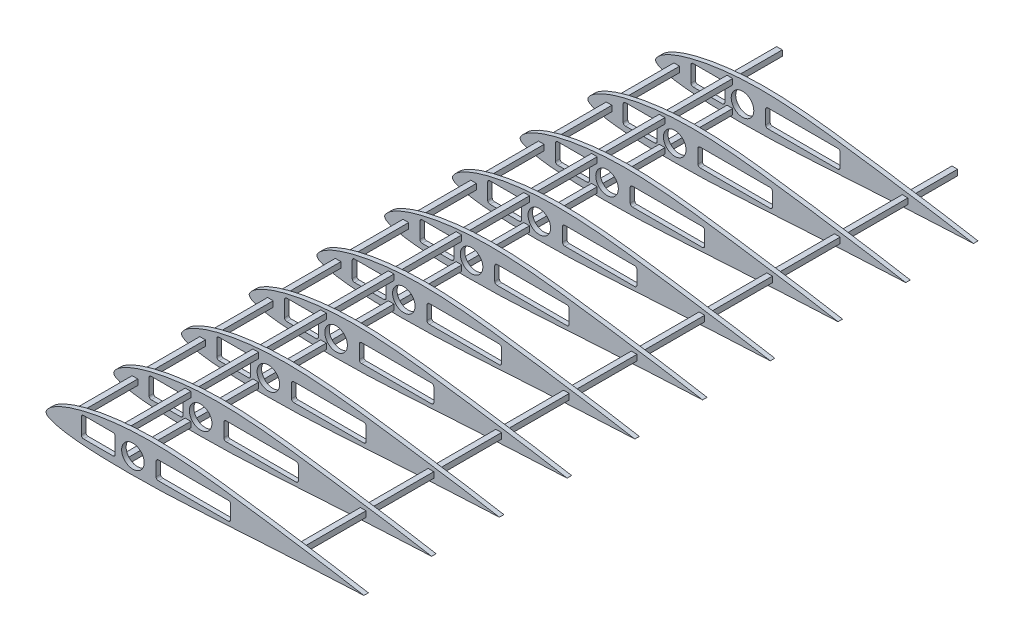
from build123d import *

# Parameters (mm, degrees)
BOSS_EXTRUDE2_DEPTH       = 5.08
BOSS_EXTRUDE3_DEPTH       = 5.08
BOSS_EXTRUDE4_DEPTH       = 5.08
BOSS_EXTRUDE5_DEPTH       = 5.08
BOSS_EXTRUDE6_DEPTH       = 5.08
BOSS_EXTRUDE7_DEPTH       = 5.08
BOSS_EXTRUDE8_DEPTH       = 5.08
BOSS_EXTRUDE9_DEPTH       = 5.08
BOSS_EXTRUDE10_DEPTH      = 5.08
BOSS_EXTRUDE11_DEPTH      = 5.08
SKETCH14_R                = 12.7
CUT_EXTRUDE2_DEPTH        = 690.88
SKETCH15_W                = 6.35
SKETCH15_H                = 6.46854383
SKETCH15_H_2              = 6.35
CUT_EXTRUDE3_DEPTH        = 779.554157664
SKETCH16_W                = 6.35
SKETCH16_H                = 6.35
BOSS_EXTRUDE12_DEPTH      = 690.88
BOSS_EXTRUDE13_DEPTH      = 50.8
BOSS_EXTRUDE13_DEPTH_BACK = 690.88
SKETCH17_W                = 6.35
SKETCH17_H                = 6.46854383
SKETCH17_H_2              = 6.35


with BuildPart() as part:
    # Sketch1 → Boss-Extrude2 (new body)
    with BuildSketch(Plane.XY):
        with BuildLine():
            add(Edge.make_bspline(
                [(357.6495768, 0), (357.650424017, 0.025663108), (354.99806757, 0.293773121), (352.370656863, 0.802364027), (346.176304678, 1.867599503), (338.781253095, 3.265504934), (329.308114231, 4.891932615), (318.248236887, 6.664827953), (305.595219858, 8.650694841), (291.563961855, 10.819266045), (276.339957136, 13.150538074), (260.139222488, 15.590297603), (243.181526396, 18.09125812), (225.69898419, 20.602703774), (207.92085948, 23.031812803), (190.087035591, 25.315205259), (172.408579332, 27.332807649), (155.046694559, 28.909580237), (138.125753593, 29.947037456), (121.743656538, 30.392160951), (105.989881508, 30.210794754), (90.943349528, 29.415500622), (76.690303822, 28.03078985), (63.327174798, 26.18677189), (50.972808774, 23.948534269), (39.752270993, 21.37905616), (29.77139745, 18.544982508), (21.131812622, 15.501783957), (13.891437198, 12.323716442), (8.139051951, 9.107469323), (3.815839027, 5.903106048), (1.180205396, 2.969325806), (-0.487670047, -0.018031277), (1.257237687, -2.928520945), (4.804987248, -4.652779402), (9.875429174, -6.636452021), (16.779998315, -8.251110396), (25.353452813, -9.701737391), (35.582842736, -10.881324092), (47.362154325, -11.802673847), (60.584190143, -12.462405601), (75.111735115, -12.860660167), (90.789721738, -13.013201083), (107.443529757, -12.913655472), (124.905168707, -12.56510888), (143.025643592, -11.886846395), (161.661678952, -10.940531092), (180.642422071, -9.857230063), (199.744199132, -8.711857459), (218.720973618, -7.552500346), (237.326277665, -6.425266584), (255.32010409, -5.353644632), (272.465183364, -4.367012218), (288.537244693, -3.475326191), (303.314765849, -2.692174609), (316.612136087, -2.020695803), (328.210351967, -1.438525319), (338.124563038, -0.910151365), (345.839521918, -0.406133073), (352.25250936, -0.129032965), (354.957272096, 0.043054655), (357.648726861, -0.025745557), (357.6495768, 0)],
                knots=[0, 0, 0, 0, 0.001748082, 0.006827365, 0.014880219, 0.025572325, 0.038694157, 0.05417078, 0.071834092, 0.091434533, 0.112684614, 0.135293129, 0.158943981, 0.183314993, 0.208069947, 0.232879416, 0.257398767, 0.281383633, 0.304705763, 0.327241497, 0.348896563, 0.36960694, 0.389308376, 0.407885696, 0.425177149, 0.44102679, 0.455299972, 0.467903885, 0.478751648, 0.487814349, 0.495090031, 0.500616983, 0.504451368, 0.507803776, 0.513091193, 0.520546229, 0.530249123, 0.542213645, 0.556382479, 0.572655502, 0.590894529, 0.610925387, 0.632535859, 0.655496365, 0.679547083, 0.704498569, 0.730211425, 0.756435525, 0.782836661, 0.80906245, 0.834775916, 0.859641281, 0.883337827, 0.905540839, 0.925965139, 0.944326313, 0.960365877, 0.973929438, 0.984907697, 0.99311134, 0.998246302, 1, 1, 1, 1], degree=3))
        make_face()
    extrude(amount=BOSS_EXTRUDE2_DEPTH)


with BuildPart() as body_2:
    # Sketch5 → Boss-Extrude3 (new body)
    with BuildSketch(Plane.XY.offset(76.2)):
        with BuildLine():
            add(Edge.make_bspline(
                [(357.6495768, 0), (357.650424017, 0.025663108), (354.99806757, 0.293773121), (352.370656863, 0.802364027), (346.176304678, 1.867599503), (338.781253095, 3.265504934), (329.308114231, 4.891932615), (318.248236887, 6.664827953), (305.595219858, 8.650694841), (291.563961855, 10.819266045), (276.339957136, 13.150538074), (260.139222488, 15.590297603), (243.181526396, 18.09125812), (225.69898419, 20.602703774), (207.92085948, 23.031812803), (190.087035591, 25.315205259), (172.408579332, 27.332807649), (155.046694559, 28.909580237), (138.125753593, 29.947037456), (121.743656538, 30.392160951), (105.989881508, 30.210794754), (90.943349528, 29.415500622), (76.690303822, 28.03078985), (63.327174798, 26.18677189), (50.972808774, 23.948534269), (39.752270993, 21.37905616), (29.77139745, 18.544982508), (21.131812622, 15.501783957), (13.891437198, 12.323716442), (8.139051951, 9.107469323), (3.815839027, 5.903106048), (1.180205396, 2.969325806), (-0.487670047, -0.018031277), (1.257237687, -2.928520945), (4.804987248, -4.652779402), (9.875429174, -6.636452021), (16.779998315, -8.251110396), (25.353452813, -9.701737391), (35.582842736, -10.881324092), (47.362154325, -11.802673847), (60.584190143, -12.462405601), (75.111735115, -12.860660167), (90.789721738, -13.013201083), (107.443529757, -12.913655472), (124.905168707, -12.56510888), (143.025643592, -11.886846395), (161.661678952, -10.940531092), (180.642422071, -9.857230063), (199.744199132, -8.711857459), (218.720973618, -7.552500346), (237.326277665, -6.425266584), (255.32010409, -5.353644632), (272.465183364, -4.367012218), (288.537244693, -3.475326191), (303.314765849, -2.692174609), (316.612136087, -2.020695803), (328.210351967, -1.438525319), (338.124563038, -0.910151365), (345.839521918, -0.406133073), (352.25250936, -0.129032965), (354.957272096, 0.043054655), (357.648726861, -0.025745557), (357.6495768, 0)],
                knots=[0, 0, 0, 0, 0.001748082, 0.006827365, 0.014880219, 0.025572325, 0.038694157, 0.05417078, 0.071834092, 0.091434533, 0.112684614, 0.135293129, 0.158943981, 0.183314993, 0.208069947, 0.232879416, 0.257398767, 0.281383633, 0.304705763, 0.327241497, 0.348896563, 0.36960694, 0.389308376, 0.407885696, 0.425177149, 0.44102679, 0.455299972, 0.467903885, 0.478751648, 0.487814349, 0.495090031, 0.500616983, 0.504451368, 0.507803776, 0.513091193, 0.520546229, 0.530249123, 0.542213645, 0.556382479, 0.572655502, 0.590894529, 0.610925387, 0.632535859, 0.655496365, 0.679547083, 0.704498569, 0.730211425, 0.756435525, 0.782836661, 0.80906245, 0.834775916, 0.859641281, 0.883337827, 0.905540839, 0.925965139, 0.944326313, 0.960365877, 0.973929438, 0.984907697, 0.99311134, 0.998246302, 1, 1, 1, 1], degree=3))
        make_face()
    extrude(amount=BOSS_EXTRUDE3_DEPTH)


with BuildPart() as body_3:
    # Sketch6 → Boss-Extrude4 (new body)
    with BuildSketch(Plane.XY.offset(152.4)):
        with BuildLine():
            add(Edge.make_bspline(
                [(357.6495768, 0), (357.650424017, 0.025663108), (354.99806757, 0.293773121), (352.370656863, 0.802364027), (346.176304678, 1.867599503), (338.781253095, 3.265504934), (329.308114231, 4.891932615), (318.248236887, 6.664827953), (305.595219858, 8.650694841), (291.563961855, 10.819266045), (276.339957136, 13.150538074), (260.139222488, 15.590297603), (243.181526396, 18.09125812), (225.69898419, 20.602703774), (207.92085948, 23.031812803), (190.087035591, 25.315205259), (172.408579332, 27.332807649), (155.046694559, 28.909580237), (138.125753593, 29.947037456), (121.743656538, 30.392160951), (105.989881508, 30.210794754), (90.943349528, 29.415500622), (76.690303822, 28.03078985), (63.327174798, 26.18677189), (50.972808774, 23.948534269), (39.752270993, 21.37905616), (29.77139745, 18.544982508), (21.131812622, 15.501783957), (13.891437198, 12.323716442), (8.139051951, 9.107469323), (3.815839027, 5.903106048), (1.180205396, 2.969325806), (-0.487670047, -0.018031277), (1.257237687, -2.928520945), (4.804987248, -4.652779402), (9.875429174, -6.636452021), (16.779998315, -8.251110396), (25.353452813, -9.701737391), (35.582842736, -10.881324092), (47.362154325, -11.802673847), (60.584190143, -12.462405601), (75.111735115, -12.860660167), (90.789721738, -13.013201083), (107.443529757, -12.913655472), (124.905168707, -12.56510888), (143.025643592, -11.886846395), (161.661678952, -10.940531092), (180.642422071, -9.857230063), (199.744199132, -8.711857459), (218.720973618, -7.552500346), (237.326277665, -6.425266584), (255.32010409, -5.353644632), (272.465183364, -4.367012218), (288.537244693, -3.475326191), (303.314765849, -2.692174609), (316.612136087, -2.020695803), (328.210351967, -1.438525319), (338.124563038, -0.910151365), (345.839521918, -0.406133073), (352.25250936, -0.129032965), (354.957272096, 0.043054655), (357.648726861, -0.025745557), (357.6495768, 0)],
                knots=[0, 0, 0, 0, 0.001748082, 0.006827365, 0.014880219, 0.025572325, 0.038694157, 0.05417078, 0.071834092, 0.091434533, 0.112684614, 0.135293129, 0.158943981, 0.183314993, 0.208069947, 0.232879416, 0.257398767, 0.281383633, 0.304705763, 0.327241497, 0.348896563, 0.36960694, 0.389308376, 0.407885696, 0.425177149, 0.44102679, 0.455299972, 0.467903885, 0.478751648, 0.487814349, 0.495090031, 0.500616983, 0.504451368, 0.507803776, 0.513091193, 0.520546229, 0.530249123, 0.542213645, 0.556382479, 0.572655502, 0.590894529, 0.610925387, 0.632535859, 0.655496365, 0.679547083, 0.704498569, 0.730211425, 0.756435525, 0.782836661, 0.80906245, 0.834775916, 0.859641281, 0.883337827, 0.905540839, 0.925965139, 0.944326313, 0.960365877, 0.973929438, 0.984907697, 0.99311134, 0.998246302, 1, 1, 1, 1], degree=3))
        make_face()
    extrude(amount=BOSS_EXTRUDE4_DEPTH)


with BuildPart() as body_4:
    # Sketch7 → Boss-Extrude5 (new body)
    with BuildSketch(Plane.XY.offset(228.6)):
        with BuildLine():
            add(Edge.make_bspline(
                [(357.6495768, 0), (357.650424017, 0.025663108), (354.99806757, 0.293773121), (352.370656863, 0.802364027), (346.176304678, 1.867599503), (338.781253095, 3.265504934), (329.308114231, 4.891932615), (318.248236887, 6.664827953), (305.595219858, 8.650694841), (291.563961855, 10.819266045), (276.339957136, 13.150538074), (260.139222488, 15.590297603), (243.181526396, 18.09125812), (225.69898419, 20.602703774), (207.92085948, 23.031812803), (190.087035591, 25.315205259), (172.408579332, 27.332807649), (155.046694559, 28.909580237), (138.125753593, 29.947037456), (121.743656538, 30.392160951), (105.989881508, 30.210794754), (90.943349528, 29.415500622), (76.690303822, 28.03078985), (63.327174798, 26.18677189), (50.972808774, 23.948534269), (39.752270993, 21.37905616), (29.77139745, 18.544982508), (21.131812622, 15.501783957), (13.891437198, 12.323716442), (8.139051951, 9.107469323), (3.815839027, 5.903106048), (1.180205396, 2.969325806), (-0.487670047, -0.018031277), (1.257237687, -2.928520945), (4.804987248, -4.652779402), (9.875429174, -6.636452021), (16.779998315, -8.251110396), (25.353452813, -9.701737391), (35.582842736, -10.881324092), (47.362154325, -11.802673847), (60.584190143, -12.462405601), (75.111735115, -12.860660167), (90.789721738, -13.013201083), (107.443529757, -12.913655472), (124.905168707, -12.56510888), (143.025643592, -11.886846395), (161.661678952, -10.940531092), (180.642422071, -9.857230063), (199.744199132, -8.711857459), (218.720973618, -7.552500346), (237.326277665, -6.425266584), (255.32010409, -5.353644632), (272.465183364, -4.367012218), (288.537244693, -3.475326191), (303.314765849, -2.692174609), (316.612136087, -2.020695803), (328.210351967, -1.438525319), (338.124563038, -0.910151365), (345.839521918, -0.406133073), (352.25250936, -0.129032965), (354.957272096, 0.043054655), (357.648726861, -0.025745557), (357.6495768, 0)],
                knots=[0, 0, 0, 0, 0.001748082, 0.006827365, 0.014880219, 0.025572325, 0.038694157, 0.05417078, 0.071834092, 0.091434533, 0.112684614, 0.135293129, 0.158943981, 0.183314993, 0.208069947, 0.232879416, 0.257398767, 0.281383633, 0.304705763, 0.327241497, 0.348896563, 0.36960694, 0.389308376, 0.407885696, 0.425177149, 0.44102679, 0.455299972, 0.467903885, 0.478751648, 0.487814349, 0.495090031, 0.500616983, 0.504451368, 0.507803776, 0.513091193, 0.520546229, 0.530249123, 0.542213645, 0.556382479, 0.572655502, 0.590894529, 0.610925387, 0.632535859, 0.655496365, 0.679547083, 0.704498569, 0.730211425, 0.756435525, 0.782836661, 0.80906245, 0.834775916, 0.859641281, 0.883337827, 0.905540839, 0.925965139, 0.944326313, 0.960365877, 0.973929438, 0.984907697, 0.99311134, 0.998246302, 1, 1, 1, 1], degree=3))
        make_face()
    extrude(amount=BOSS_EXTRUDE5_DEPTH)


with BuildPart() as body_5:
    # Sketch8 → Boss-Extrude6 (new body)
    with BuildSketch(Plane.XY.offset(304.8)):
        with BuildLine():
            add(Edge.make_bspline(
                [(357.6495768, 0), (357.650424017, 0.025663108), (354.99806757, 0.293773121), (352.370656863, 0.802364027), (346.176304678, 1.867599503), (338.781253095, 3.265504934), (329.308114231, 4.891932615), (318.248236887, 6.664827953), (305.595219858, 8.650694841), (291.563961855, 10.819266045), (276.339957136, 13.150538074), (260.139222488, 15.590297603), (243.181526396, 18.09125812), (225.69898419, 20.602703774), (207.92085948, 23.031812803), (190.087035591, 25.315205259), (172.408579332, 27.332807649), (155.046694559, 28.909580237), (138.125753593, 29.947037456), (121.743656538, 30.392160951), (105.989881508, 30.210794754), (90.943349528, 29.415500622), (76.690303822, 28.03078985), (63.327174798, 26.18677189), (50.972808774, 23.948534269), (39.752270993, 21.37905616), (29.77139745, 18.544982508), (21.131812622, 15.501783957), (13.891437198, 12.323716442), (8.139051951, 9.107469323), (3.815839027, 5.903106048), (1.180205396, 2.969325806), (-0.487670047, -0.018031277), (1.257237687, -2.928520945), (4.804987248, -4.652779402), (9.875429174, -6.636452021), (16.779998315, -8.251110396), (25.353452813, -9.701737391), (35.582842736, -10.881324092), (47.362154325, -11.802673847), (60.584190143, -12.462405601), (75.111735115, -12.860660167), (90.789721738, -13.013201083), (107.443529757, -12.913655472), (124.905168707, -12.56510888), (143.025643592, -11.886846395), (161.661678952, -10.940531092), (180.642422071, -9.857230063), (199.744199132, -8.711857459), (218.720973618, -7.552500346), (237.326277665, -6.425266584), (255.32010409, -5.353644632), (272.465183364, -4.367012218), (288.537244693, -3.475326191), (303.314765849, -2.692174609), (316.612136087, -2.020695803), (328.210351967, -1.438525319), (338.124563038, -0.910151365), (345.839521918, -0.406133073), (352.25250936, -0.129032965), (354.957272096, 0.043054655), (357.648726861, -0.025745557), (357.6495768, 0)],
                knots=[0, 0, 0, 0, 0.001748082, 0.006827365, 0.014880219, 0.025572325, 0.038694157, 0.05417078, 0.071834092, 0.091434533, 0.112684614, 0.135293129, 0.158943981, 0.183314993, 0.208069947, 0.232879416, 0.257398767, 0.281383633, 0.304705763, 0.327241497, 0.348896563, 0.36960694, 0.389308376, 0.407885696, 0.425177149, 0.44102679, 0.455299972, 0.467903885, 0.478751648, 0.487814349, 0.495090031, 0.500616983, 0.504451368, 0.507803776, 0.513091193, 0.520546229, 0.530249123, 0.542213645, 0.556382479, 0.572655502, 0.590894529, 0.610925387, 0.632535859, 0.655496365, 0.679547083, 0.704498569, 0.730211425, 0.756435525, 0.782836661, 0.80906245, 0.834775916, 0.859641281, 0.883337827, 0.905540839, 0.925965139, 0.944326313, 0.960365877, 0.973929438, 0.984907697, 0.99311134, 0.998246302, 1, 1, 1, 1], degree=3))
        make_face()
    extrude(amount=BOSS_EXTRUDE6_DEPTH)


with BuildPart() as body_6:
    # Sketch9 → Boss-Extrude7 (new body)
    with BuildSketch(Plane.XY.offset(381)):
        with BuildLine():
            add(Edge.make_bspline(
                [(357.6495768, 0), (357.650424017, 0.025663108), (354.99806757, 0.293773121), (352.370656863, 0.802364027), (346.176304678, 1.867599503), (338.781253095, 3.265504934), (329.308114231, 4.891932615), (318.248236887, 6.664827953), (305.595219858, 8.650694841), (291.563961855, 10.819266045), (276.339957136, 13.150538074), (260.139222488, 15.590297603), (243.181526396, 18.09125812), (225.69898419, 20.602703774), (207.92085948, 23.031812803), (190.087035591, 25.315205259), (172.408579332, 27.332807649), (155.046694559, 28.909580237), (138.125753593, 29.947037456), (121.743656538, 30.392160951), (105.989881508, 30.210794754), (90.943349528, 29.415500622), (76.690303822, 28.03078985), (63.327174798, 26.18677189), (50.972808774, 23.948534269), (39.752270993, 21.37905616), (29.77139745, 18.544982508), (21.131812622, 15.501783957), (13.891437198, 12.323716442), (8.139051951, 9.107469323), (3.815839027, 5.903106048), (1.180205396, 2.969325806), (-0.487670047, -0.018031277), (1.257237687, -2.928520945), (4.804987248, -4.652779402), (9.875429174, -6.636452021), (16.779998315, -8.251110396), (25.353452813, -9.701737391), (35.582842736, -10.881324092), (47.362154325, -11.802673847), (60.584190143, -12.462405601), (75.111735115, -12.860660167), (90.789721738, -13.013201083), (107.443529757, -12.913655472), (124.905168707, -12.56510888), (143.025643592, -11.886846395), (161.661678952, -10.940531092), (180.642422071, -9.857230063), (199.744199132, -8.711857459), (218.720973618, -7.552500346), (237.326277665, -6.425266584), (255.32010409, -5.353644632), (272.465183364, -4.367012218), (288.537244693, -3.475326191), (303.314765849, -2.692174609), (316.612136087, -2.020695803), (328.210351967, -1.438525319), (338.124563038, -0.910151365), (345.839521918, -0.406133073), (352.25250936, -0.129032965), (354.957272096, 0.043054655), (357.648726861, -0.025745557), (357.6495768, 0)],
                knots=[0, 0, 0, 0, 0.001748082, 0.006827365, 0.014880219, 0.025572325, 0.038694157, 0.05417078, 0.071834092, 0.091434533, 0.112684614, 0.135293129, 0.158943981, 0.183314993, 0.208069947, 0.232879416, 0.257398767, 0.281383633, 0.304705763, 0.327241497, 0.348896563, 0.36960694, 0.389308376, 0.407885696, 0.425177149, 0.44102679, 0.455299972, 0.467903885, 0.478751648, 0.487814349, 0.495090031, 0.500616983, 0.504451368, 0.507803776, 0.513091193, 0.520546229, 0.530249123, 0.542213645, 0.556382479, 0.572655502, 0.590894529, 0.610925387, 0.632535859, 0.655496365, 0.679547083, 0.704498569, 0.730211425, 0.756435525, 0.782836661, 0.80906245, 0.834775916, 0.859641281, 0.883337827, 0.905540839, 0.925965139, 0.944326313, 0.960365877, 0.973929438, 0.984907697, 0.99311134, 0.998246302, 1, 1, 1, 1], degree=3))
        make_face()
    extrude(amount=BOSS_EXTRUDE7_DEPTH)


with BuildPart() as body_7:
    # Sketch10 → Boss-Extrude8 (new body)
    with BuildSketch(Plane.XY.offset(457.2)):
        with BuildLine():
            add(Edge.make_bspline(
                [(357.6495768, 0), (357.650424017, 0.025663108), (354.99806757, 0.293773121), (352.370656863, 0.802364027), (346.176304678, 1.867599503), (338.781253095, 3.265504934), (329.308114231, 4.891932615), (318.248236887, 6.664827953), (305.595219858, 8.650694841), (291.563961855, 10.819266045), (276.339957136, 13.150538074), (260.139222488, 15.590297603), (243.181526396, 18.09125812), (225.69898419, 20.602703774), (207.92085948, 23.031812803), (190.087035591, 25.315205259), (172.408579332, 27.332807649), (155.046694559, 28.909580237), (138.125753593, 29.947037456), (121.743656538, 30.392160951), (105.989881508, 30.210794754), (90.943349528, 29.415500622), (76.690303822, 28.03078985), (63.327174798, 26.18677189), (50.972808774, 23.948534269), (39.752270993, 21.37905616), (29.77139745, 18.544982508), (21.131812622, 15.501783957), (13.891437198, 12.323716442), (8.139051951, 9.107469323), (3.815839027, 5.903106048), (1.180205396, 2.969325806), (-0.487670047, -0.018031277), (1.257237687, -2.928520945), (4.804987248, -4.652779402), (9.875429174, -6.636452021), (16.779998315, -8.251110396), (25.353452813, -9.701737391), (35.582842736, -10.881324092), (47.362154325, -11.802673847), (60.584190143, -12.462405601), (75.111735115, -12.860660167), (90.789721738, -13.013201083), (107.443529757, -12.913655472), (124.905168707, -12.56510888), (143.025643592, -11.886846395), (161.661678952, -10.940531092), (180.642422071, -9.857230063), (199.744199132, -8.711857459), (218.720973618, -7.552500346), (237.326277665, -6.425266584), (255.32010409, -5.353644632), (272.465183364, -4.367012218), (288.537244693, -3.475326191), (303.314765849, -2.692174609), (316.612136087, -2.020695803), (328.210351967, -1.438525319), (338.124563038, -0.910151365), (345.839521918, -0.406133073), (352.25250936, -0.129032965), (354.957272096, 0.043054655), (357.648726861, -0.025745557), (357.6495768, 0)],
                knots=[0, 0, 0, 0, 0.001748082, 0.006827365, 0.014880219, 0.025572325, 0.038694157, 0.05417078, 0.071834092, 0.091434533, 0.112684614, 0.135293129, 0.158943981, 0.183314993, 0.208069947, 0.232879416, 0.257398767, 0.281383633, 0.304705763, 0.327241497, 0.348896563, 0.36960694, 0.389308376, 0.407885696, 0.425177149, 0.44102679, 0.455299972, 0.467903885, 0.478751648, 0.487814349, 0.495090031, 0.500616983, 0.504451368, 0.507803776, 0.513091193, 0.520546229, 0.530249123, 0.542213645, 0.556382479, 0.572655502, 0.590894529, 0.610925387, 0.632535859, 0.655496365, 0.679547083, 0.704498569, 0.730211425, 0.756435525, 0.782836661, 0.80906245, 0.834775916, 0.859641281, 0.883337827, 0.905540839, 0.925965139, 0.944326313, 0.960365877, 0.973929438, 0.984907697, 0.99311134, 0.998246302, 1, 1, 1, 1], degree=3))
        make_face()
    extrude(amount=BOSS_EXTRUDE8_DEPTH)


with BuildPart() as body_8:
    # Sketch11 → Boss-Extrude9 (new body)
    with BuildSketch(Plane.XY.offset(533.4)):
        with BuildLine():
            add(Edge.make_bspline(
                [(357.6495768, 0), (357.650424017, 0.025663108), (354.99806757, 0.293773121), (352.370656863, 0.802364027), (346.176304678, 1.867599503), (338.781253095, 3.265504934), (329.308114231, 4.891932615), (318.248236887, 6.664827953), (305.595219858, 8.650694841), (291.563961855, 10.819266045), (276.339957136, 13.150538074), (260.139222488, 15.590297603), (243.181526396, 18.09125812), (225.69898419, 20.602703774), (207.92085948, 23.031812803), (190.087035591, 25.315205259), (172.408579332, 27.332807649), (155.046694559, 28.909580237), (138.125753593, 29.947037456), (121.743656538, 30.392160951), (105.989881508, 30.210794754), (90.943349528, 29.415500622), (76.690303822, 28.03078985), (63.327174798, 26.18677189), (50.972808774, 23.948534269), (39.752270993, 21.37905616), (29.77139745, 18.544982508), (21.131812622, 15.501783957), (13.891437198, 12.323716442), (8.139051951, 9.107469323), (3.815839027, 5.903106048), (1.180205396, 2.969325806), (-0.487670047, -0.018031277), (1.257237687, -2.928520945), (4.804987248, -4.652779402), (9.875429174, -6.636452021), (16.779998315, -8.251110396), (25.353452813, -9.701737391), (35.582842736, -10.881324092), (47.362154325, -11.802673847), (60.584190143, -12.462405601), (75.111735115, -12.860660167), (90.789721738, -13.013201083), (107.443529757, -12.913655472), (124.905168707, -12.56510888), (143.025643592, -11.886846395), (161.661678952, -10.940531092), (180.642422071, -9.857230063), (199.744199132, -8.711857459), (218.720973618, -7.552500346), (237.326277665, -6.425266584), (255.32010409, -5.353644632), (272.465183364, -4.367012218), (288.537244693, -3.475326191), (303.314765849, -2.692174609), (316.612136087, -2.020695803), (328.210351967, -1.438525319), (338.124563038, -0.910151365), (345.839521918, -0.406133073), (352.25250936, -0.129032965), (354.957272096, 0.043054655), (357.648726861, -0.025745557), (357.6495768, 0)],
                knots=[0, 0, 0, 0, 0.001748082, 0.006827365, 0.014880219, 0.025572325, 0.038694157, 0.05417078, 0.071834092, 0.091434533, 0.112684614, 0.135293129, 0.158943981, 0.183314993, 0.208069947, 0.232879416, 0.257398767, 0.281383633, 0.304705763, 0.327241497, 0.348896563, 0.36960694, 0.389308376, 0.407885696, 0.425177149, 0.44102679, 0.455299972, 0.467903885, 0.478751648, 0.487814349, 0.495090031, 0.500616983, 0.504451368, 0.507803776, 0.513091193, 0.520546229, 0.530249123, 0.542213645, 0.556382479, 0.572655502, 0.590894529, 0.610925387, 0.632535859, 0.655496365, 0.679547083, 0.704498569, 0.730211425, 0.756435525, 0.782836661, 0.80906245, 0.834775916, 0.859641281, 0.883337827, 0.905540839, 0.925965139, 0.944326313, 0.960365877, 0.973929438, 0.984907697, 0.99311134, 0.998246302, 1, 1, 1, 1], degree=3))
        make_face()
    extrude(amount=BOSS_EXTRUDE9_DEPTH)


with BuildPart() as body_9:
    # Sketch12 → Boss-Extrude10 (new body)
    with BuildSketch(Plane.XY.offset(609.6)):
        with BuildLine():
            add(Edge.make_bspline(
                [(357.6495768, 0), (357.650424017, 0.025663108), (354.99806757, 0.293773121), (352.370656863, 0.802364027), (346.176304678, 1.867599503), (338.781253095, 3.265504934), (329.308114231, 4.891932615), (318.248236887, 6.664827953), (305.595219858, 8.650694841), (291.563961855, 10.819266045), (276.339957136, 13.150538074), (260.139222488, 15.590297603), (243.181526396, 18.09125812), (225.69898419, 20.602703774), (207.92085948, 23.031812803), (190.087035591, 25.315205259), (172.408579332, 27.332807649), (155.046694559, 28.909580237), (138.125753593, 29.947037456), (121.743656538, 30.392160951), (105.989881508, 30.210794754), (90.943349528, 29.415500622), (76.690303822, 28.03078985), (63.327174798, 26.18677189), (50.972808774, 23.948534269), (39.752270993, 21.37905616), (29.77139745, 18.544982508), (21.131812622, 15.501783957), (13.891437198, 12.323716442), (8.139051951, 9.107469323), (3.815839027, 5.903106048), (1.180205396, 2.969325806), (-0.487670047, -0.018031277), (1.257237687, -2.928520945), (4.804987248, -4.652779402), (9.875429174, -6.636452021), (16.779998315, -8.251110396), (25.353452813, -9.701737391), (35.582842736, -10.881324092), (47.362154325, -11.802673847), (60.584190143, -12.462405601), (75.111735115, -12.860660167), (90.789721738, -13.013201083), (107.443529757, -12.913655472), (124.905168707, -12.56510888), (143.025643592, -11.886846395), (161.661678952, -10.940531092), (180.642422071, -9.857230063), (199.744199132, -8.711857459), (218.720973618, -7.552500346), (237.326277665, -6.425266584), (255.32010409, -5.353644632), (272.465183364, -4.367012218), (288.537244693, -3.475326191), (303.314765849, -2.692174609), (316.612136087, -2.020695803), (328.210351967, -1.438525319), (338.124563038, -0.910151365), (345.839521918, -0.406133073), (352.25250936, -0.129032965), (354.957272096, 0.043054655), (357.648726861, -0.025745557), (357.6495768, 0)],
                knots=[0, 0, 0, 0, 0.001748082, 0.006827365, 0.014880219, 0.025572325, 0.038694157, 0.05417078, 0.071834092, 0.091434533, 0.112684614, 0.135293129, 0.158943981, 0.183314993, 0.208069947, 0.232879416, 0.257398767, 0.281383633, 0.304705763, 0.327241497, 0.348896563, 0.36960694, 0.389308376, 0.407885696, 0.425177149, 0.44102679, 0.455299972, 0.467903885, 0.478751648, 0.487814349, 0.495090031, 0.500616983, 0.504451368, 0.507803776, 0.513091193, 0.520546229, 0.530249123, 0.542213645, 0.556382479, 0.572655502, 0.590894529, 0.610925387, 0.632535859, 0.655496365, 0.679547083, 0.704498569, 0.730211425, 0.756435525, 0.782836661, 0.80906245, 0.834775916, 0.859641281, 0.883337827, 0.905540839, 0.925965139, 0.944326313, 0.960365877, 0.973929438, 0.984907697, 0.99311134, 0.998246302, 1, 1, 1, 1], degree=3))
        make_face()
    extrude(amount=BOSS_EXTRUDE10_DEPTH)


with BuildPart() as body_10:
    # Sketch13 → Boss-Extrude11 (new body)
    with BuildSketch(Plane.XY.offset(685.8)):
        with BuildLine():
            add(Edge.make_bspline(
                [(357.6495768, 0), (357.650424017, 0.025663108), (354.99806757, 0.293773121), (352.370656863, 0.802364027), (346.176304678, 1.867599503), (338.781253095, 3.265504934), (329.308114231, 4.891932615), (318.248236887, 6.664827953), (305.595219858, 8.650694841), (291.563961855, 10.819266045), (276.339957136, 13.150538074), (260.139222488, 15.590297603), (243.181526396, 18.09125812), (225.69898419, 20.602703774), (207.92085948, 23.031812803), (190.087035591, 25.315205259), (172.408579332, 27.332807649), (155.046694559, 28.909580237), (138.125753593, 29.947037456), (121.743656538, 30.392160951), (105.989881508, 30.210794754), (90.943349528, 29.415500622), (76.690303822, 28.03078985), (63.327174798, 26.18677189), (50.972808774, 23.948534269), (39.752270993, 21.37905616), (29.77139745, 18.544982508), (21.131812622, 15.501783957), (13.891437198, 12.323716442), (8.139051951, 9.107469323), (3.815839027, 5.903106048), (1.180205396, 2.969325806), (-0.487670047, -0.018031277), (1.257237687, -2.928520945), (4.804987248, -4.652779402), (9.875429174, -6.636452021), (16.779998315, -8.251110396), (25.353452813, -9.701737391), (35.582842736, -10.881324092), (47.362154325, -11.802673847), (60.584190143, -12.462405601), (75.111735115, -12.860660167), (90.789721738, -13.013201083), (107.443529757, -12.913655472), (124.905168707, -12.56510888), (143.025643592, -11.886846395), (161.661678952, -10.940531092), (180.642422071, -9.857230063), (199.744199132, -8.711857459), (218.720973618, -7.552500346), (237.326277665, -6.425266584), (255.32010409, -5.353644632), (272.465183364, -4.367012218), (288.537244693, -3.475326191), (303.314765849, -2.692174609), (316.612136087, -2.020695803), (328.210351967, -1.438525319), (338.124563038, -0.910151365), (345.839521918, -0.406133073), (352.25250936, -0.129032965), (354.957272096, 0.043054655), (357.648726861, -0.025745557), (357.6495768, 0)],
                knots=[0, 0, 0, 0, 0.001748082, 0.006827365, 0.014880219, 0.025572325, 0.038694157, 0.05417078, 0.071834092, 0.091434533, 0.112684614, 0.135293129, 0.158943981, 0.183314993, 0.208069947, 0.232879416, 0.257398767, 0.281383633, 0.304705763, 0.327241497, 0.348896563, 0.36960694, 0.389308376, 0.407885696, 0.425177149, 0.44102679, 0.455299972, 0.467903885, 0.478751648, 0.487814349, 0.495090031, 0.500616983, 0.504451368, 0.507803776, 0.513091193, 0.520546229, 0.530249123, 0.542213645, 0.556382479, 0.572655502, 0.590894529, 0.610925387, 0.632535859, 0.655496365, 0.679547083, 0.704498569, 0.730211425, 0.756435525, 0.782836661, 0.80906245, 0.834775916, 0.859641281, 0.883337827, 0.905540839, 0.925965139, 0.944326313, 0.960365877, 0.973929438, 0.984907697, 0.99311134, 0.998246302, 1, 1, 1, 1], degree=3))
        make_face()
    extrude(amount=BOSS_EXTRUDE11_DEPTH)


with BuildPart() as cut_extrude2_tool:
    # Sketch14 → Cut-Extrude2 (new body)
    with BuildSketch(Plane(origin=(0, 0, 0), x_dir=(-1, 0, 0), z_dir=(0, 0, -1))):
        with Locations((-97.769905174, 5.76384731)):
            Circle(SKETCH14_R)
        with BuildLine():
            Line((-126.37619784, 16.407723517), (-205.11619784, 16.407723517))
            ThreePointArc((-205.11619784, 16.407723517), (-206.912249065, 15.663774741), (-207.65619784, 13.867723517))
            Line((-207.65619784, 13.867723517), (-207.65619784, -1.372276483))
            ThreePointArc((-207.65619784, -1.372276483), (-206.912249065, -3.168327707), (-205.11619784, -3.912276483))
            Line((-205.11619784, -3.912276483), (-126.37619784, -3.912276483))
            ThreePointArc((-126.37619784, -3.912276483), (-124.580146616, -3.168327707), (-123.83619784, -1.372276483))
            Line((-123.83619784, -1.372276483), (-123.83619784, 13.867723517))
            ThreePointArc((-123.83619784, 13.867723517), (-124.580146616, 15.663774741), (-126.37619784, 16.407723517))
        make_face()
        with BuildLine():
            Line((-75.285241846, 17.677723517), (-42.265241846, 17.677723517))
            ThreePointArc((-42.265241846, 17.677723517), (-40.469190622, 16.933774741), (-39.725241846, 15.137723517))
            Line((-39.725241846, 15.137723517), (-39.725241846, -2.642276483))
            ThreePointArc((-39.725241846, -2.642276483), (-40.469190622, -4.438327707), (-42.265241846, -5.182276483))
            Line((-42.265241846, -5.182276483), (-75.285241846, -5.182276483))
            ThreePointArc((-75.285241846, -5.182276483), (-77.08129307, -4.438327707), (-77.825241846, -2.642276483))
            Line((-77.825241846, -2.642276483), (-77.825241846, 15.137723517))
            ThreePointArc((-77.825241846, 15.137723517), (-77.08129307, 16.933774741), (-75.285241846, 17.677723517))
        make_face()
    extrude(amount=-CUT_EXTRUDE2_DEPTH)


with BuildPart() as part_1:
    add(part.part)

    # Cut-Extrude2: cut by cut_extrude2_tool
    add(cut_extrude2_tool.part, mode=Mode.SUBTRACT)


with BuildPart() as body_2_1:
    add(body_2.part)

    # Cut-Extrude2: cut by cut_extrude2_tool
    add(cut_extrude2_tool.part, mode=Mode.SUBTRACT)


with BuildPart() as body_3_1:
    add(body_3.part)

    # Cut-Extrude2: cut by cut_extrude2_tool
    add(cut_extrude2_tool.part, mode=Mode.SUBTRACT)


with BuildPart() as body_4_1:
    add(body_4.part)

    # Cut-Extrude2: cut by cut_extrude2_tool
    add(cut_extrude2_tool.part, mode=Mode.SUBTRACT)


with BuildPart() as body_5_1:
    add(body_5.part)

    # Cut-Extrude2: cut by cut_extrude2_tool
    add(cut_extrude2_tool.part, mode=Mode.SUBTRACT)


with BuildPart() as body_6_1:
    add(body_6.part)

    # Cut-Extrude2: cut by cut_extrude2_tool
    add(cut_extrude2_tool.part, mode=Mode.SUBTRACT)


with BuildPart() as body_7_1:
    add(body_7.part)

    # Cut-Extrude2: cut by cut_extrude2_tool
    add(cut_extrude2_tool.part, mode=Mode.SUBTRACT)


with BuildPart() as body_8_1:
    add(body_8.part)

    # Cut-Extrude2: cut by cut_extrude2_tool
    add(cut_extrude2_tool.part, mode=Mode.SUBTRACT)


with BuildPart() as body_9_1:
    add(body_9.part)

    # Cut-Extrude2: cut by cut_extrude2_tool
    add(cut_extrude2_tool.part, mode=Mode.SUBTRACT)


with BuildPart() as body_10_1:
    add(body_10.part)

    # Cut-Extrude2: cut by cut_extrude2_tool
    add(cut_extrude2_tool.part, mode=Mode.SUBTRACT)


with BuildPart() as cut_extrude3_tool:
    # Sketch15 → Cut-Extrude3 (new, through all)
    with BuildSketch(Plane(origin=(0, 0, 0), x_dir=(-1, 0, 0), z_dir=(0, 0, -1))):
        with Locations((-280.68119784, 4.283451602)):
            Rectangle(SKETCH15_W, SKETCH15_H)
        with Locations((-23.850241846, 4.342723517)):
            Rectangle(SKETCH15_W, SKETCH15_H_2)
        with Locations((-83.540241846, 22.122723517)):
            Rectangle(SKETCH15_W, SKETCH15_H_2)
        with Locations((-83.540241846, -7.087276483)):
            Rectangle(SKETCH15_W, SKETCH15_H_2)
    extrude(amount=-CUT_EXTRUDE3_DEPTH)


with BuildPart() as part_2:
    add(part_1.part)

    # Cut-Extrude3: cut by cut_extrude3_tool
    add(cut_extrude3_tool.part, mode=Mode.SUBTRACT)



with BuildPart() as body_2_2:
    add(body_2_1.part)

    # Cut-Extrude3: cut by cut_extrude3_tool
    add(cut_extrude3_tool.part, mode=Mode.SUBTRACT)


with BuildPart() as body_3_2:
    add(body_3_1.part)

    # Cut-Extrude3: cut by cut_extrude3_tool
    add(cut_extrude3_tool.part, mode=Mode.SUBTRACT)


with BuildPart() as body_4_2:
    add(body_4_1.part)

    # Cut-Extrude3: cut by cut_extrude3_tool
    add(cut_extrude3_tool.part, mode=Mode.SUBTRACT)


with BuildPart() as body_5_2:
    add(body_5_1.part)

    # Cut-Extrude3: cut by cut_extrude3_tool
    add(cut_extrude3_tool.part, mode=Mode.SUBTRACT)


with BuildPart() as body_6_2:
    add(body_6_1.part)

    # Cut-Extrude3: cut by cut_extrude3_tool
    add(cut_extrude3_tool.part, mode=Mode.SUBTRACT)


with BuildPart() as body_7_2:
    add(body_7_1.part)

    # Cut-Extrude3: cut by cut_extrude3_tool
    add(cut_extrude3_tool.part, mode=Mode.SUBTRACT)


with BuildPart() as body_8_2:
    add(body_8_1.part)

    # Cut-Extrude3: cut by cut_extrude3_tool
    add(cut_extrude3_tool.part, mode=Mode.SUBTRACT)


with BuildPart() as body_9_2:
    add(body_9_1.part)

    # Cut-Extrude3: cut by cut_extrude3_tool
    add(cut_extrude3_tool.part, mode=Mode.SUBTRACT)


with BuildPart() as body_10_2:
    add(body_10_1.part)

    # Cut-Extrude3: cut by cut_extrude3_tool
    add(cut_extrude3_tool.part, mode=Mode.SUBTRACT)


with BuildPart() as part_3:
    add(part_2.part)

    add(body_2_2.part)  # Boss-Extrude12 merges body 2

    add(body_3_2.part)  # Boss-Extrude12 merges body 3

    add(body_4_2.part)  # Boss-Extrude12 merges body 4

    add(body_5_2.part)  # Boss-Extrude12 merges body 5

    add(body_6_2.part)  # Boss-Extrude12 merges body 6

    add(body_7_2.part)  # Boss-Extrude12 merges body 7

    add(body_8_2.part)  # Boss-Extrude12 merges body 8

    add(body_9_2.part)  # Boss-Extrude12 merges body 9

    add(body_10_2.part)  # Boss-Extrude12 merges body 10
    # Sketch16 → Boss-Extrude12 (add, through all)
    with BuildSketch(Plane(origin=(0, 0, 0), x_dir=(-1, 0, 0), z_dir=(0, 0, -1))):
        with Locations((-83.540241846, -7.087276483)):
            Rectangle(SKETCH16_W, SKETCH16_H)
        with Locations((-23.850241846, 4.342723517)):
            Rectangle(SKETCH16_W, SKETCH16_H)
    extrude(amount=-BOSS_EXTRUDE12_DEPTH)

    # Sketch17 → Boss-Extrude13 (add, two sides: drawn at the far end of the back side and taken through both)
    with BuildSketch(Plane(origin=(0, 0, 0), x_dir=(-1, 0, 0), z_dir=(0, 0, -1)).offset(-BOSS_EXTRUDE13_DEPTH_BACK)):
        with Locations((-280.68119784, 4.283451602)):
            Rectangle(SKETCH17_W, SKETCH17_H)
        with Locations((-83.540241846, 22.122723517)):
            Rectangle(SKETCH17_W, SKETCH17_H_2)
    extrude(amount=BOSS_EXTRUDE13_DEPTH + BOSS_EXTRUDE13_DEPTH_BACK)


solid = part_3.part
